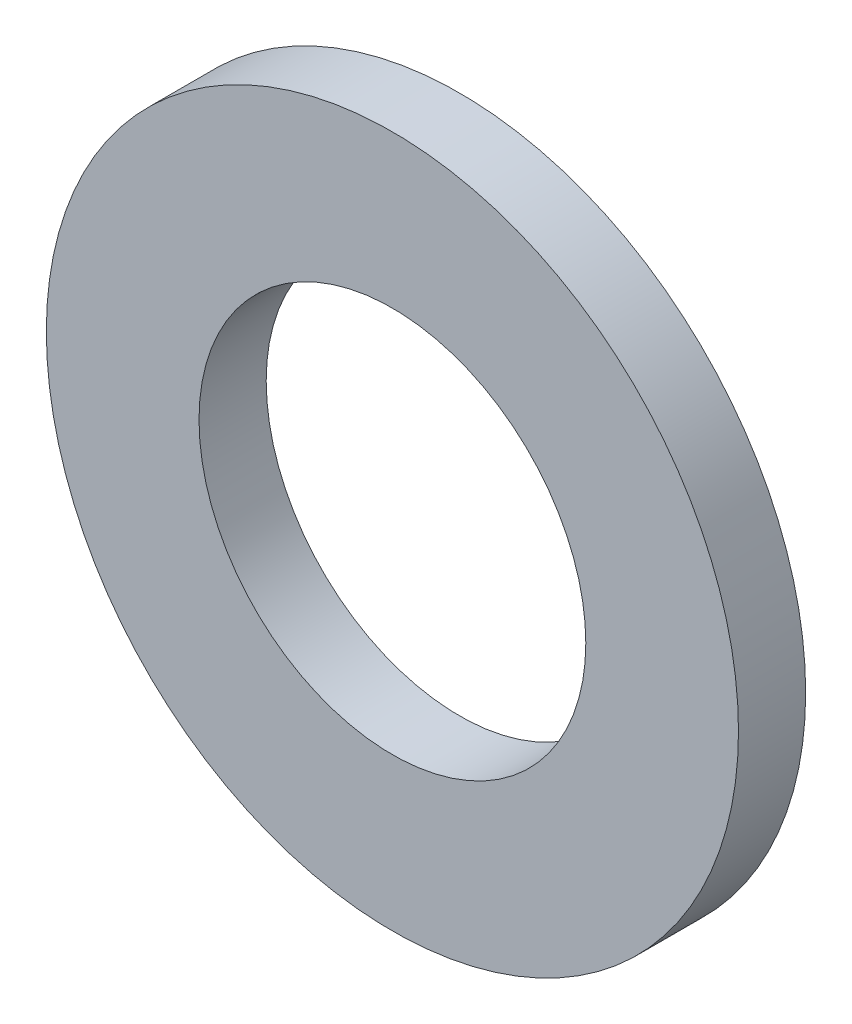
from build123d import *

# Parameters (mm, degrees)
SKETCH1_R           = 17
SKETCH1_R_2         = 9.5
BOSS_EXTRUDE1_DEPTH = 3.3


with BuildPart() as part:
    # Sketch1 → Boss-Extrude1 (new body)
    with BuildSketch(Plane.XY):
        Circle(SKETCH1_R)
        Circle(SKETCH1_R_2, mode=Mode.SUBTRACT)
    extrude(amount=BOSS_EXTRUDE1_DEPTH)


solid = part.part
